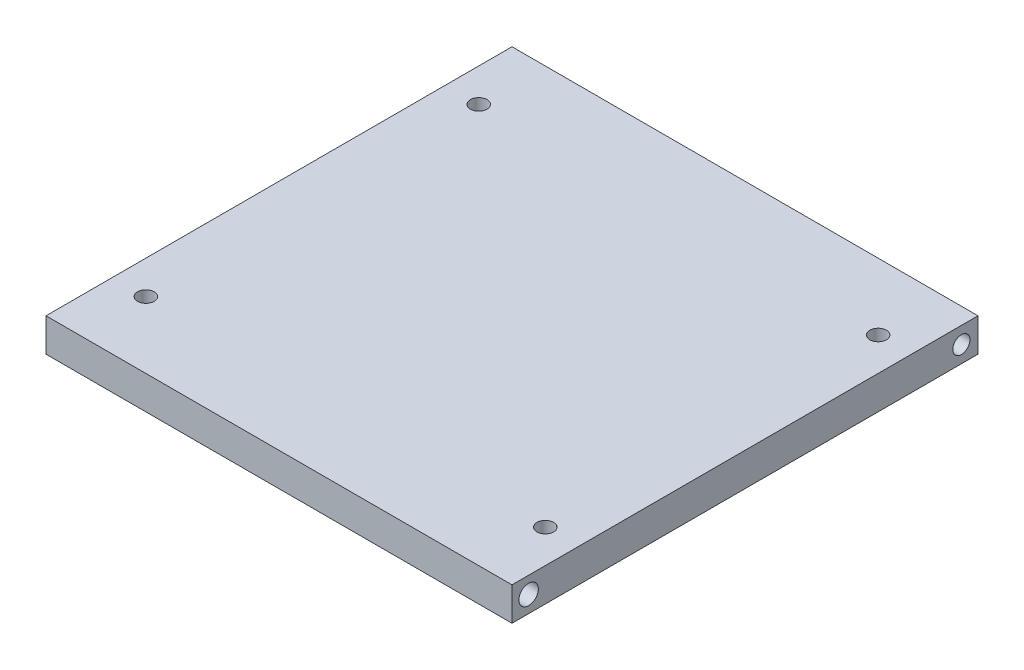
from build123d import *

# Parameters (mm, degrees)
SKETCH1_W            = 84
SKETCH1_H            = 84
BOSS_EXTRUDE1_DEPTH  = 6
SKETCH2_R            = 1.5
CUT_EXTRUDE1_DEPTH   = 6
LPATTERN1_COUNT      = 2
LPATTERN1_PITCH      = 72
LPATTERN1_COUNT_DIR2 = 2
LPATTERN1_PITCH_DIR2 = 60
SKETCH3_R            = 1.549904247
SKETCH3_R_2          = 1.748244363
CUT_EXTRUDE2_DEPTH   = 10


with BuildPart() as part:
    # Sketch1 → Boss-Extrude1 (new body)
    with BuildSketch(Plane(origin=(0, 0, 0), x_dir=(1, 0, 0), z_dir=(0, 1, 0))):
        with Locations((42, 42)):
            Rectangle(SKETCH1_W, SKETCH1_H)
    extrude(amount=BOSS_EXTRUDE1_DEPTH)

    # Sketch2 → Cut-Extrude1 (cut)
    with BuildSketch(Plane(origin=(0, 6, 0), x_dir=(1, 0, 0), z_dir=(0, 1, 0))):
        with Locations(Location((6, 72, 0), (0, 0, 270))):
            Circle(SKETCH2_R)
    cut_extrude1 = extrude(amount=-CUT_EXTRUDE1_DEPTH, mode=Mode.SUBTRACT)

    # LPattern1: Cut-Extrude1 2 × 2
    with Locations(*[(i * LPATTERN1_PITCH, 0, j * LPATTERN1_PITCH_DIR2) for i in range(LPATTERN1_COUNT) for j in range(LPATTERN1_COUNT_DIR2) if (i, j) != (0, 0)]):
        add(cut_extrude1, mode=Mode.SUBTRACT)

    # Sketch3 → Cut-Extrude2 (cut)
    with BuildSketch(Plane.ZY):
        with Locations((-81, 3)):
            Circle(SKETCH3_R)
        with Locations((-3, 3)):
            Circle(SKETCH3_R_2)
    cut_extrude2 = extrude(amount=-CUT_EXTRUDE2_DEPTH, mode=Mode.SUBTRACT)

    # Mirror1: Cut-Extrude2 across plane
    add(cut_extrude2.mirror(Plane.ZY.offset(-42)), mode=Mode.SUBTRACT)


solid = part.part
